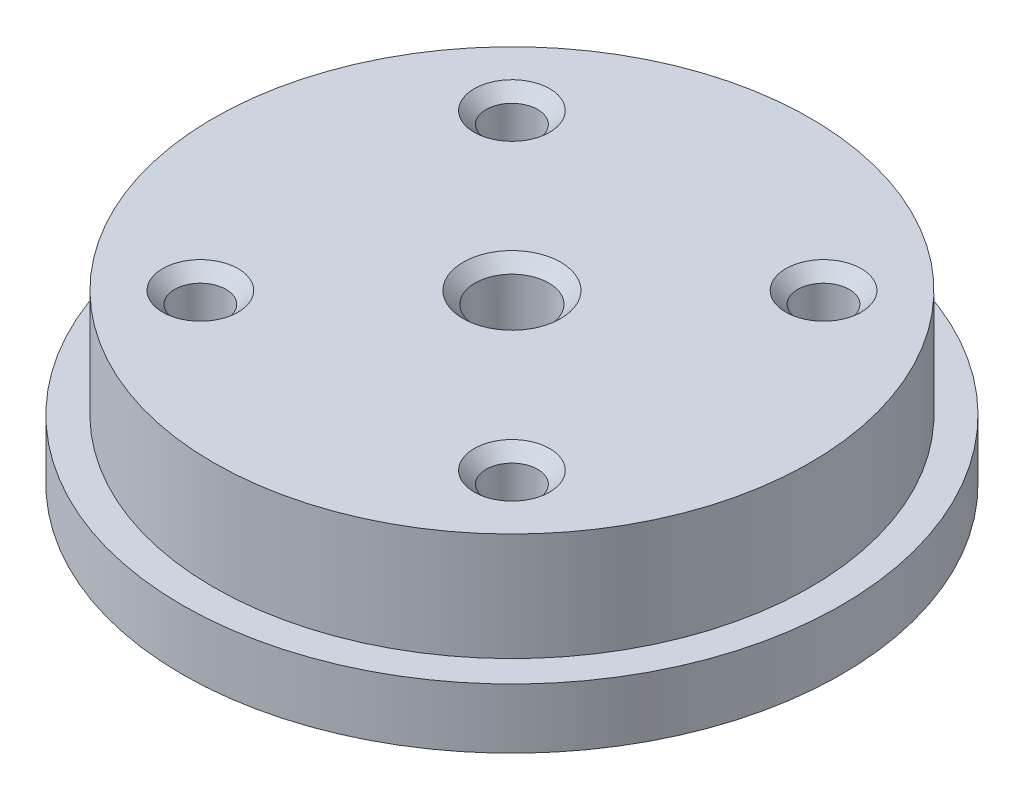
from build123d import *

# Parameters (mm, degrees)
F_2_5_2_5_DURCHMESSER_BOHRUNG1_D           = 2.5
F_2_5_2_5_DURCHMESSER_BOHRUNG1_DEPTH       = 9
F_2_5_2_5_DURCHMESSER_BOHRUNG1_CSINK_D     = 3.25
F_2_5_2_5_DURCHMESSER_BOHRUNG1_CSINK_ANGLE = 90
F_2_5_2_5_DURCHMESSER_BOHRUNG1_TIP         = 0.751075774
SKIZZE5_R                                  = 3.075
SKIZZE5_R_2                                = 2.15
SCHNITT_LINEAR_AUSTRAGEN1_DEPTH            = 9
FASE1_SIZE                                 = 1


with BuildPart() as part:
    # Skizze1 → Rotation1 (revolve)
    with BuildSketch(Plane.XY, mode=Mode.PRIVATE) as rotation1_sk:
        Polygon((10.6, 0), (27.5, 0), (27.5, 5), (24.9, 5), (24.9, 14), (0, 14), (0, 5.5), (7.5, 5.5), (7.5, 5), (10.6, 5), align=None)
    revolve(rotation1_sk.sketch.rotate(Axis((0, 0, 0), (0, -1, 0)), 90), axis=Axis((0, 0, 0), (0, -1, 0)))

    # Ø2.5 (2.5) Durchmesser Bohrung1
    with Locations(Plane(origin=(0, 0, 0), x_dir=(-1, 0, 0), z_dir=(0, -1, 0))):
        with Locations((-16.02146997, 9.25), (0, 18.5), (16.02146997, 9.25), (16.02146997, -9.25), (0, -18.5), (-16.02146997, -9.25)):
            CounterSinkHole(F_2_5_2_5_DURCHMESSER_BOHRUNG1_D / 2, F_2_5_2_5_DURCHMESSER_BOHRUNG1_CSINK_D / 2, depth=F_2_5_2_5_DURCHMESSER_BOHRUNG1_DEPTH, counter_sink_angle=F_2_5_2_5_DURCHMESSER_BOHRUNG1_CSINK_ANGLE)
            with Locations((0, 0, -(F_2_5_2_5_DURCHMESSER_BOHRUNG1_DEPTH + F_2_5_2_5_DURCHMESSER_BOHRUNG1_TIP / 2))):  # 118° drill point
                Cone(0, F_2_5_2_5_DURCHMESSER_BOHRUNG1_D / 2, F_2_5_2_5_DURCHMESSER_BOHRUNG1_TIP, mode=Mode.SUBTRACT)

    # Skizze5 → Schnitt-Linear austragen1 (cut)
    with BuildSketch(Plane(origin=(0, 14, 0), x_dir=(1, 0, 0), z_dir=(0, 1, 0))):
        with Locations(Location((0, 0, 0), (0, 0, 270))):
            Circle(SKIZZE5_R)
        with Locations(Location((13, 13, 0), (0, 0, 270))):
            Circle(SKIZZE5_R_2)
        with Locations(Location((13, -13, 0), (0, 0, 270))):
            Circle(SKIZZE5_R_2)
        with Locations(Location((-13, -13, 0), (0, 0, 270))):
            Circle(SKIZZE5_R_2)
        with Locations(Location((-13, 13, 0), (0, 0, 270))):
            Circle(SKIZZE5_R_2)
    extrude(amount=-SCHNITT_LINEAR_AUSTRAGEN1_DEPTH, mode=Mode.SUBTRACT)

    # Fase1
    fase1_edges = [part.edges().sort_by_distance(p)[0] for p in [
        (-13, 14, -15.15),
        (-13, 14, 10.85),
        (13, 14, 10.85),
        (13, 14, -15.15),
        (0, 14, -3.075),
    ]]
    chamfer(fase1_edges, length=FASE1_SIZE)


solid = part.part
